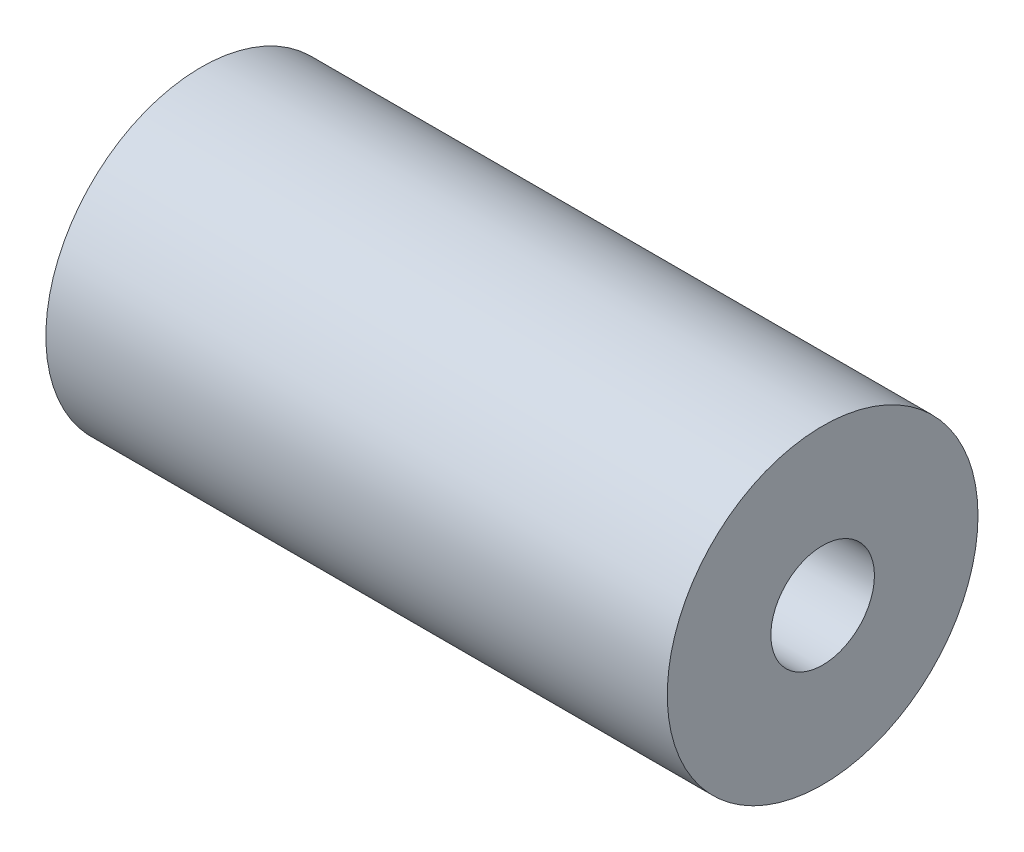
from build123d import *

# Parameters (mm, degrees)
SKETCH1_R           = 30
SKETCH1_R_2         = 10
BOSS_EXTRUDE1_DEPTH = 120


with BuildPart() as part:
    # Sketch1 → Boss-Extrude1 (new body)
    with BuildSketch(Plane(origin=(0, 0, 0), x_dir=(0, 0, -1), z_dir=(1, 0, 0))):
        Circle(SKETCH1_R)
        Circle(SKETCH1_R_2, mode=Mode.SUBTRACT)
    extrude(amount=BOSS_EXTRUDE1_DEPTH)


solid = part.part
